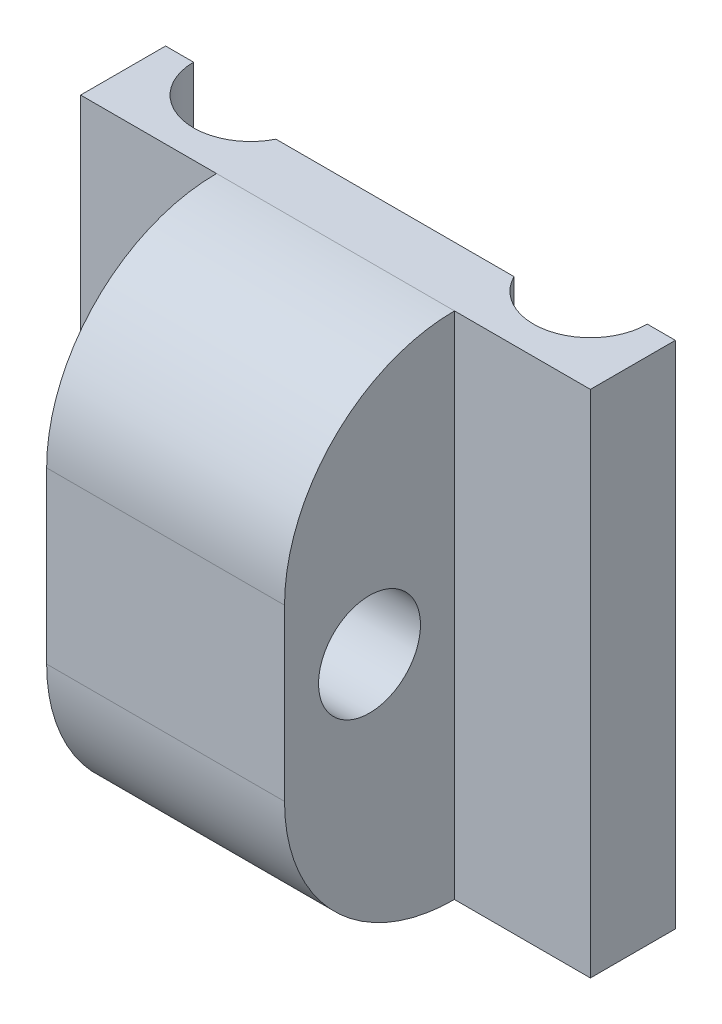
from build123d import *

# Parameters (mm, degrees)
BOSS_EXTRUDE1_DEPTH     = 30
CUT_EXTRUDE2_DEPTH      = 46
CUT_EXTRUDE2_DEPTH_BACK = 46
SKETCH3_R               = 3
CUT_EXTRUDE3_DEPTH      = 46
CUT_EXTRUDE3_DEPTH_BACK = 46
SKETCH4_W               = 15.866839518
SKETCH4_H               = 1.721603904
FILLET1_R               = 10
CUT_EXTRUDE4_DEPTH      = 46
CUT_EXTRUDE4_DEPTH_BACK = 46
SKETCH5_W               = 8
SKETCH5_H               = 10


with BuildPart() as part:
    # Sketch1 → Boss-Extrude1 (new body)
    with BuildSketch(Plane(origin=(0, 0, 0), x_dir=(1, 0, 0), z_dir=(0, 1, 0))):
        with BuildLine():
            Line((8.35, 15), (21.65, 15))
            ThreePointArc((21.65, 15), (25, 11.65), (28.35, 15))
            Line((28.35, 15), (30, 15))
            Line((30, 15), (30, 0))
            Line((30, 0), (0, 0))
            Line((0, 0), (0, 15))
            Line((0, 15), (1.65, 15))
            ThreePointArc((1.65, 15), (5, 11.65), (8.35, 15))
        make_face()
    extrude(amount=BOSS_EXTRUDE1_DEPTH)

    # Sketch3 → Cut-Extrude2 (cut, two sides: drawn at the far end of the back side and taken through both)
    with BuildSketch(Plane.ZY.offset(-CUT_EXTRUDE2_DEPTH_BACK)):
        with Locations((-5, 15)):
            Circle(SKETCH3_R)
    extrude(amount=CUT_EXTRUDE2_DEPTH + CUT_EXTRUDE2_DEPTH_BACK, mode=Mode.SUBTRACT)

    # Sketch4 → Cut-Extrude3 (cut, two sides: drawn at the far end of the back side and taken through both)
    with BuildSketch(Plane.XZ.offset(-CUT_EXTRUDE3_DEPTH_BACK)):
        with Locations((14.711914925, -14.360801952)):
            Rectangle(SKETCH4_W, SKETCH4_H)
    extrude(amount=CUT_EXTRUDE3_DEPTH + CUT_EXTRUDE3_DEPTH_BACK, mode=Mode.SUBTRACT)

    # Fillet1
    fillet1_edges = [part.edges().sort_by_distance(p)[0] for p in [
        (15, 0, 0),
        (15, 30, 0),
    ]]
    fillet(fillet1_edges, radius=FILLET1_R)

    # Sketch5 → Cut-Extrude4 (cut, two sides: drawn at the far end of the back side and taken through both)
    with BuildSketch(Plane.XZ.offset(-CUT_EXTRUDE4_DEPTH_BACK)):
        with Locations((4, -5)):
            Rectangle(SKETCH5_W, SKETCH5_H)
        with Locations((26, -5)):
            Rectangle(SKETCH5_W, SKETCH5_H)
    extrude(amount=CUT_EXTRUDE4_DEPTH + CUT_EXTRUDE4_DEPTH_BACK, mode=Mode.SUBTRACT)


solid = part.part
